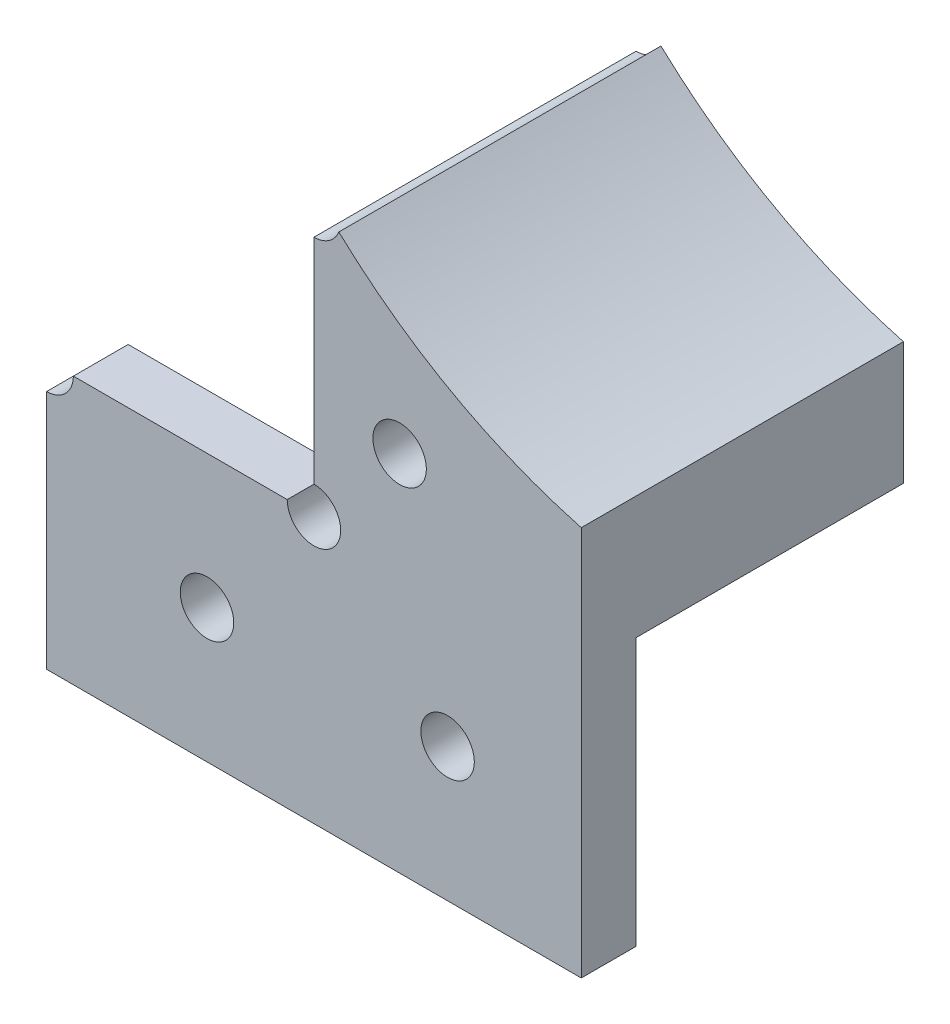
from build123d import *

# Parameters (mm, degrees)
SKETCH_1_W          = 40
SKETCH_1_H          = 20
SKETCH_1_R          = 2
EXTRUDE_1_DEPTH     = 4.1
SKETCH_2_W          = 20
SKETCH_2_H          = 20
EXTRUDE_2_DEPTH     = 24.1
SKETCH_3_R          = 2
CUT_EXTRUDE_1_DEPTH = 49.793544655


with BuildPart() as part:
    # 草图1 → 凸台-拉伸1 (new body)
    with BuildSketch(Plane.XY):
        with Locations((-10, 0)):
            Rectangle(SKETCH_1_W, SKETCH_1_H)
        Circle(SKETCH_1_R, mode=Mode.SUBTRACT)
    extrude(amount=EXTRUDE_1_DEPTH)

    # 草图2 → 凸台-拉伸2 (add)
    with BuildSketch(Plane.XY.offset(4.1)):
        with Locations((0, 20)):
            Rectangle(SKETCH_2_W, SKETCH_2_H)
    extrude(amount=-EXTRUDE_2_DEPTH)

    # 草图3 → 切除-拉伸1 (cut, through all)
    with BuildSketch(Plane.XY.offset(4.1)):
        with Locations((-18, 0)):
            Circle(SKETCH_3_R)
        with Locations((-30, 10)):
            Circle(SKETCH_3_R)
        with Locations((-3.589185504, 17.178371007)):
            Circle(SKETCH_3_R)
        with BuildLine():
            Line((-11.952534179, 30.433140022), (-10, 28))
            ThreePointArc((-10, 28), (-8.873826297, 28.347204553), (-8.138665231, 29.26826721))
            ThreePointArc((-8.138665231, 29.26826721), (0.312733547, 23.112455845), (10, 19.178371007))
            Line((10, 19.178371007), (10, 30))
            Line((10, 30), (-8, 30))
            ThreePointArc((-8, 30), (-9.78213348, 31.988098131), (-11.952534179, 30.433140022))
        make_face()
        with BuildLine():
            Line((-12, 10), (-10, 12))
            ThreePointArc((-10, 12), (-8.585786438, 8.585786438), (-12, 10))
        make_face()
    extrude(amount=-CUT_EXTRUDE_1_DEPTH, mode=Mode.SUBTRACT)


solid = part.part
